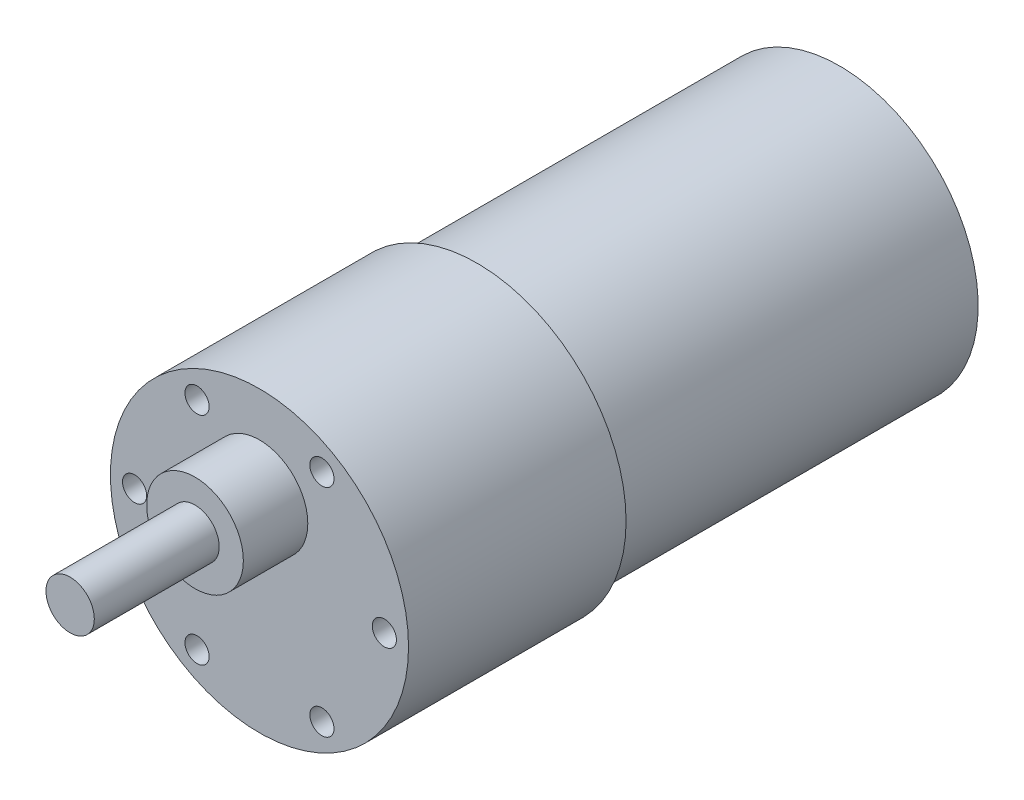
from build123d import *

# Parameters (mm, degrees)
SKETCH_1_R          = 17.2
EXTRUDE_1_DEPTH     = 45
SKETCH_2_R          = 18.5
EXTRUDE_2_DEPTH     = 27
SKETCH_6_R          = 1.5
CUT_EXTRUDE_1_DEPTH = 10
SKETCH_3_R          = 6
EXTRUDE_3_DEPTH     = 8
SKETCH_4_R          = 3
EXTRUDE_4_DEPTH     = 15.5


with BuildPart() as part:
    # 草图1 → 凸台-拉伸1 (new body)
    with BuildSketch(Plane.XY):
        with Locations(Location((0, 0, 0), (0, 0, 180))):
            Circle(SKETCH_1_R)
    extrude(amount=EXTRUDE_1_DEPTH)

    # 草图2 → 凸台-拉伸2 (add)
    with BuildSketch(Plane.XY.offset(45)):
        Circle(SKETCH_2_R)
    extrude(amount=EXTRUDE_2_DEPTH)

    # 草图6 → 切除-拉伸1 (cut)
    with BuildSketch(Plane.XY.offset(72)):
        with Locations((-15.5, 0)):
            Circle(SKETCH_6_R)
        with Locations((-7.75, 13.423393759)):
            Circle(SKETCH_6_R)
        with Locations((7.75, 13.423393759)):
            Circle(SKETCH_6_R)
        with Locations((15.5, 0)):
            Circle(SKETCH_6_R)
        with Locations((7.75, -13.423393759)):
            Circle(SKETCH_6_R)
        with Locations((-7.75, -13.423393759)):
            Circle(SKETCH_6_R)
    extrude(amount=-CUT_EXTRUDE_1_DEPTH, mode=Mode.SUBTRACT)

    # 草图3 → 凸台-拉伸3 (add)
    with BuildSketch(Plane.XY.offset(72)):
        with Locations((0, 7)):
            Circle(SKETCH_3_R)
    extrude(amount=EXTRUDE_3_DEPTH)

    # 草图4 → 凸台-拉伸4 (add)
    with BuildSketch(Plane.XY.offset(80)):
        with Locations((0, 7)):
            Circle(SKETCH_4_R)
    extrude(amount=EXTRUDE_4_DEPTH)


solid = part.part
